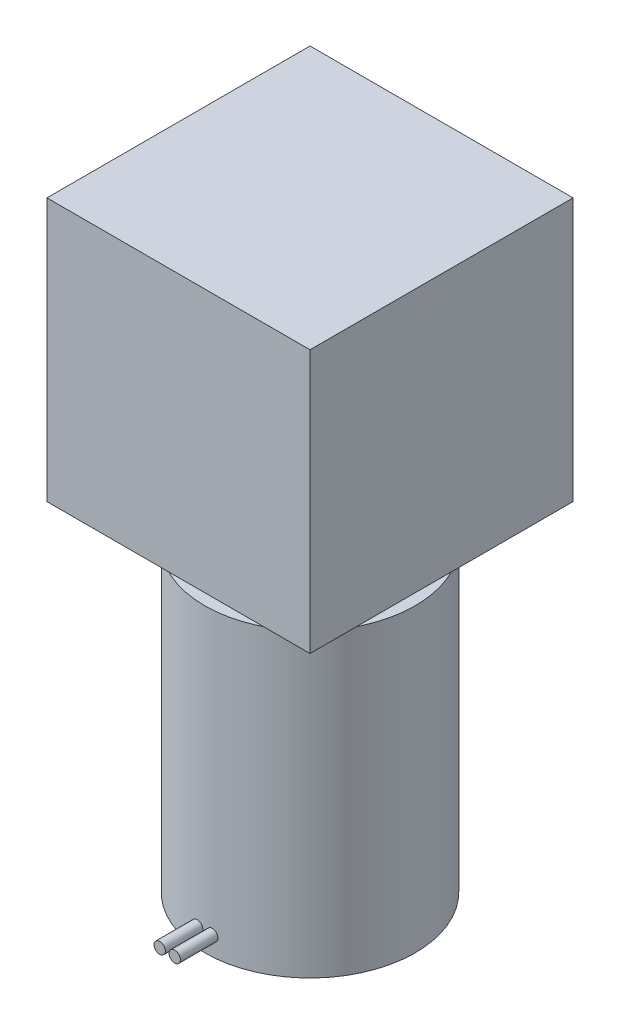
from build123d import *

# Parameters (mm, degrees)
SKETCH1_R             = 28
BOSS_EXTRUDE1_DEPTH   = 80
SKETCH3_R             = 22.5
BOSS_EXTRUDE2_DEPTH   = 10
SKETCH4_W             = 70
SKETCH4_H             = 70
BOSS_EXTRUDE3_DEPTH   = 70
SKETCH5_R             = 5.5
SKETCH5_R_2           = 2.5
CUT_EXTRUDE1_DEPTH    = 20
SKETCH6_R             = 1.5
BOSS_EXTRUDE4_DEPTH   = 10
BOSS_EXTRUDE4_2_DEPTH = 10
SKETCH7_W             = 2
SKETCH7_H             = 3
CUT_EXTRUDE2_DEPTH    = 20
SKETCH8_R             = 18.415438001
SKETCH8_R_2           = 7.734274919
CUT_EXTRUDE4_DEPTH    = 10


with BuildPart() as part:
    # Sketch1 → Boss-Extrude1 (new body)
    with BuildSketch(Plane(origin=(0, 0, 0), x_dir=(1, 0, 0), z_dir=(0, 1, 0))):
        with Locations(Location((0, 0, 0), (0, 0, 270))):
            Circle(SKETCH1_R)
    extrude(amount=BOSS_EXTRUDE1_DEPTH)

    # Sketch3 → Boss-Extrude2 (add)
    with BuildSketch(Plane(origin=(0, 80, 0), x_dir=(1, 0, 0), z_dir=(0, 1, 0))):
        with Locations(Location((0, 0, 0), (0, 0, 270))):
            Circle(SKETCH3_R)
    extrude(amount=BOSS_EXTRUDE2_DEPTH)

    # Sketch4 → Boss-Extrude3 (add)
    with BuildSketch(Plane(origin=(0, 90, 0), x_dir=(1, 0, 0), z_dir=(0, 1, 0))):
        Rectangle(SKETCH4_W, SKETCH4_H)
    extrude(amount=BOSS_EXTRUDE3_DEPTH)

    # Sketch5 → Cut-Extrude1 (cut)
    with BuildSketch(Plane.ZY.offset(35)):
        with Locations((0, 125)):
            Circle(SKETCH5_R)
        with Locations((0, 152)):
            Circle(SKETCH5_R_2)
        with Locations((19.091883092, 144.091883092)):
            Circle(SKETCH5_R_2)
        with Locations((27, 125)):
            Circle(SKETCH5_R_2)
        with Locations((19.091883092, 105.908116908)):
            Circle(SKETCH5_R_2)
        with Locations((0, 98)):
            Circle(SKETCH5_R_2)
        with Locations((-19.091883092, 105.908116908)):
            Circle(SKETCH5_R_2)
        with Locations((-27, 125)):
            Circle(SKETCH5_R_2)
        with Locations((-19.091883092, 144.091883092)):
            Circle(SKETCH5_R_2)
    extrude(amount=-CUT_EXTRUDE1_DEPTH, mode=Mode.SUBTRACT)

    # Sketch7 → Cut-Extrude2 (cut)
    with BuildSketch(Plane.ZY.offset(35)):
        with Locations((-5.5, 125)):
            Rectangle(SKETCH7_W, SKETCH7_H)
    extrude(amount=-CUT_EXTRUDE2_DEPTH, mode=Mode.SUBTRACT)

    # Sketch8 → Cut-Extrude4 (cut)
    with BuildSketch(Plane.ZY.offset(35)):
        with Locations((0, 125)):
            Circle(SKETCH8_R)
        with Locations((0, 125)):
            Circle(SKETCH8_R_2, mode=Mode.SUBTRACT)
    extrude(amount=-CUT_EXTRUDE4_DEPTH, mode=Mode.SUBTRACT)


with BuildPart() as body_2:
    # Sketch6 → Boss-Extrude4 (new body)
    with BuildSketch(Plane.XY.offset(28)):
        with Locations((-2, 5.153889314)):
            Circle(SKETCH6_R)
    extrude(amount=BOSS_EXTRUDE4_DEPTH)


with BuildPart() as body_3:
    # Sketch6 → Boss-Extrude4 2 (new body)
    with BuildSketch(Plane.XY.offset(28)):
        with Locations((2, 5.153889314)):
            Circle(SKETCH6_R)
    extrude(amount=BOSS_EXTRUDE4_2_DEPTH)


solid = Compound([part.part, body_2.part, body_3.part])
